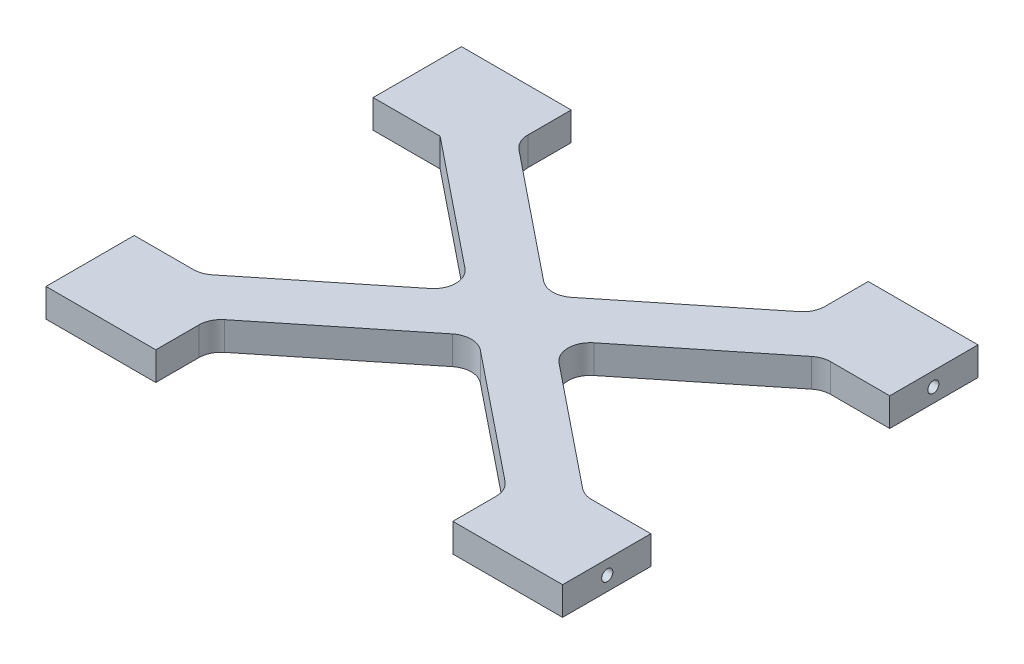
from build123d import *

# Parameters (mm, degrees)
BOSS_EXTRUDE1_DEPTH = 6.35
FILLET1_R           = 5
SKETCH2_R           = 1.25
CUT_EXTRUDE1_DEPTH  = 20


with BuildPart() as part:
    # Sketch1 → Boss-Extrude1 (new body)
    with BuildSketch(Plane(origin=(0, 0, 0), x_dir=(1, 0, 0), z_dir=(0, 1, 0))):
        Polygon((-57.825, 26.738412941), (-42.825, 26.738412941), (-9.574489714, 0), (-42.825, -26.738412941), (-57.825, -26.738412941), (-57.825, -46.5), (-33.250510286, -46.5), (-33.250510286, -34.437743191), (0, -7.69933025), (33.250510286, -34.437743191), (33.250510286, -46.5), (57.825, -46.5), (57.825, -26.738412941), (42.825, -26.738412941), (9.574489714, 0), (42.825, 26.738412941), (57.825, 26.738412941), (57.825, 46.5), (33.250510286, 46.5), (33.250510286, 34.437743191), (0, 7.69933025), (-33.250510286, 34.437743191), (-33.250510286, 46.5), (-57.825, 46.5), align=None)
    extrude(amount=BOSS_EXTRUDE1_DEPTH)

    # Fillet1
    fillet1_edges = [part.edges().sort_by_distance(p)[0] for p in [
        (-33.250510286, 3.175, -34.437743191),
        (0, 3.175, -7.69933025),
        (33.250510286, 3.175, -34.437743191),
        (42.825, 3.175, -26.738412941),
        (9.574489714, 3.175, 0),
        (42.825, 3.175, 26.738412941),
        (33.250510286, 3.175, 34.437743191),
        (0, 3.175, 7.69933025),
        (-33.250510286, 3.175, 34.437743191),
        (-42.825, 3.175, 26.738412941),
        (-9.574489714, 3.175, 0),
    ]]
    fillet(fillet1_edges, radius=FILLET1_R)

    # Sketch2 → Cut-Extrude1 (cut)
    with BuildSketch(Plane(origin=(57.825, 0, 0), x_dir=(0, 0, -1), z_dir=(1, 0, 0))):
        with Locations((36.5, 3.175)):
            Circle(SKETCH2_R)
        with Locations(Location((-36.5, 3.175, 0), (0, 0, 180))):
            Circle(SKETCH2_R)
    cut_extrude1 = extrude(amount=-CUT_EXTRUDE1_DEPTH, mode=Mode.SUBTRACT)

    # Mirror1: Cut-Extrude1 across plane
    add(cut_extrude1.mirror(Plane(origin=(0, 0, 0), x_dir=(0, 0, 1), z_dir=(1, 0, 0))), mode=Mode.SUBTRACT)


solid = part.part
